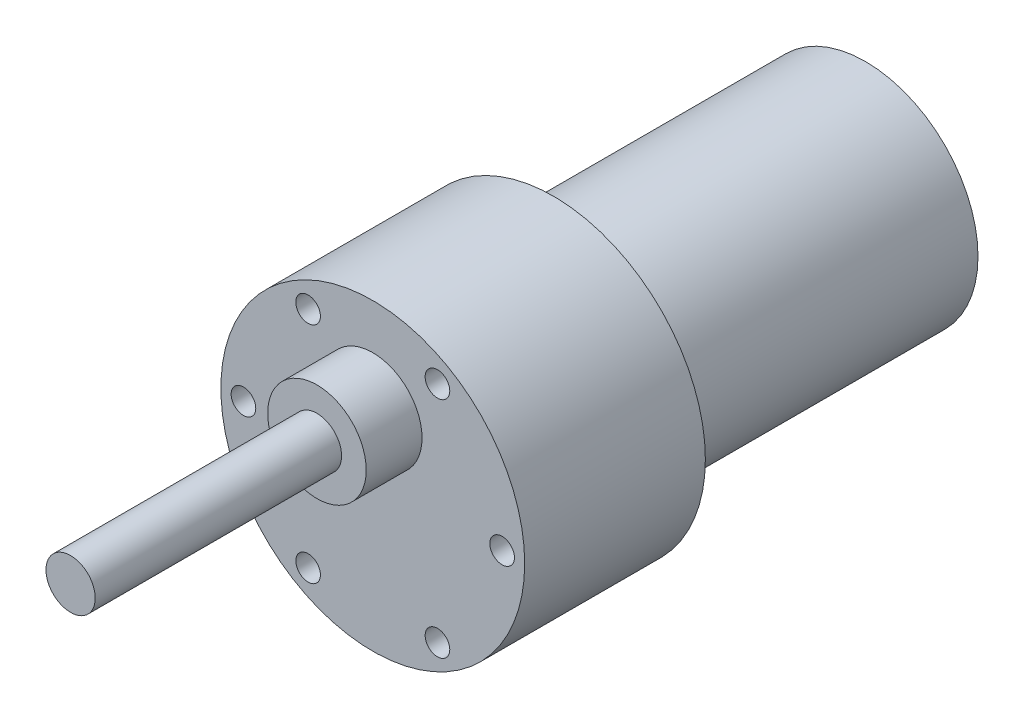
from build123d import *

# Parameters (mm, degrees)
SKETCH1_R           = 13.7
BOSS_EXTRUDE1_DEPTH = 38
SKETCH2_R           = 18.5
BOSS_EXTRUDE2_DEPTH = 22
SKETCH3_R           = 6
BOSS_EXTRUDE3_DEPTH = 6.8
SKETCH4_R           = 3
BOSS_EXTRUDE4_DEPTH = 30
SKETCH5_R           = 1.5
CUT_EXTRUDE1_DEPTH  = 5


with BuildPart() as part:
    # Sketch1 → Boss-Extrude1 (new body)
    with BuildSketch(Plane.XY):
        Circle(SKETCH1_R)
    extrude(amount=BOSS_EXTRUDE1_DEPTH)

    # Sketch2 → Boss-Extrude2 (add)
    with BuildSketch(Plane.XY.offset(38)):
        Circle(SKETCH2_R)
    extrude(amount=BOSS_EXTRUDE2_DEPTH)

    # Sketch3 → Boss-Extrude3 (add)
    with BuildSketch(Plane.XY.offset(60)):
        with Locations((0, 7)):
            Circle(SKETCH3_R)
    extrude(amount=BOSS_EXTRUDE3_DEPTH)

    # Sketch4 → Boss-Extrude4 (add)
    with BuildSketch(Plane.XY.offset(66.8)):
        with Locations((0, 7)):
            Circle(SKETCH4_R)
    extrude(amount=BOSS_EXTRUDE4_DEPTH)

    # Sketch5 → Cut-Extrude1 (cut)
    with BuildSketch(Plane.XY.offset(60)):
        with Locations((-15.75, 0)):
            Circle(SKETCH5_R)
        with Locations((-7.875, 13.63990011)):
            Circle(SKETCH5_R)
        with Locations((7.875, 13.63990011)):
            Circle(SKETCH5_R)
        with Locations((15.75, 0)):
            Circle(SKETCH5_R)
        with Locations((7.875, -13.63990011)):
            Circle(SKETCH5_R)
        with Locations((-7.875, -13.63990011)):
            Circle(SKETCH5_R)
    extrude(amount=-CUT_EXTRUDE1_DEPTH, mode=Mode.SUBTRACT)


solid = part.part
